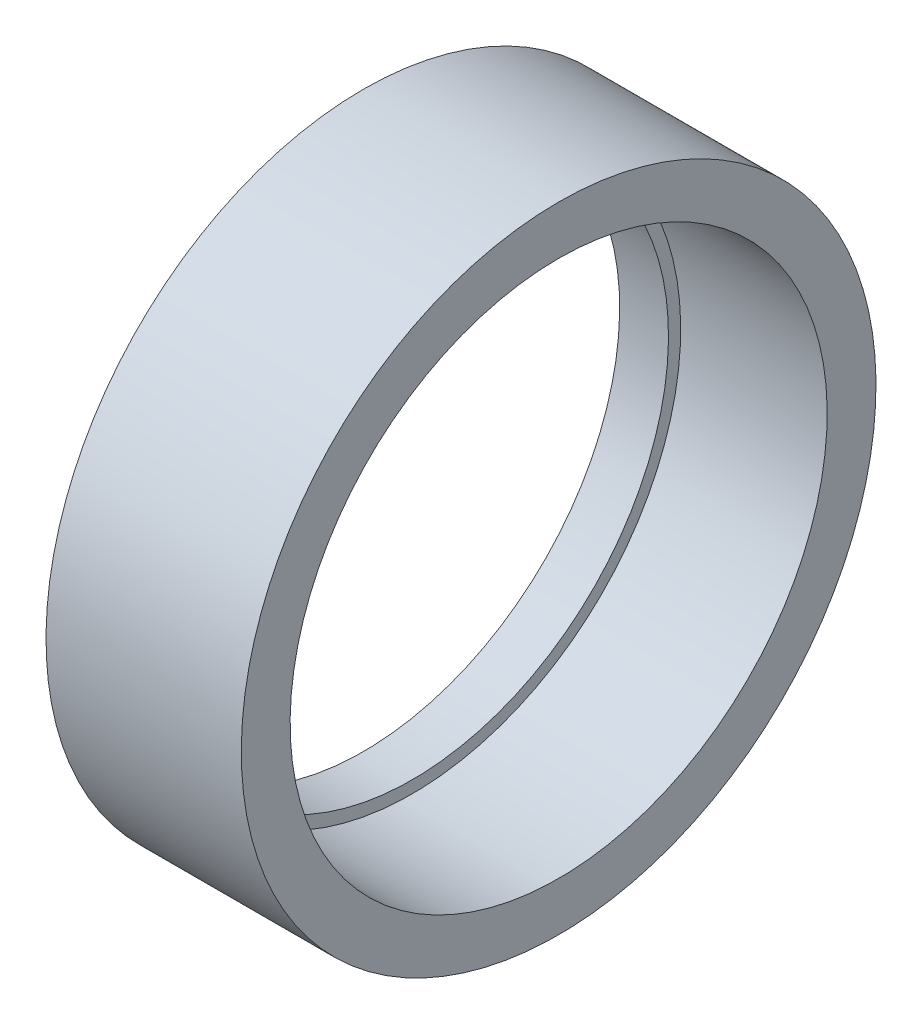
from build123d import *


with BuildPart() as part:
    # Sketch2 → Revolve1 (revolve)
    with BuildSketch(Plane.XY):
        Polygon((0, 11), (0, 13), (-8, 13), (-8, 10.5), (-6, 10.5), (-6, 11), align=None)
    revolve(axis=Axis((0, 0, 0), (-1, 0, 0)))


solid = part.part
